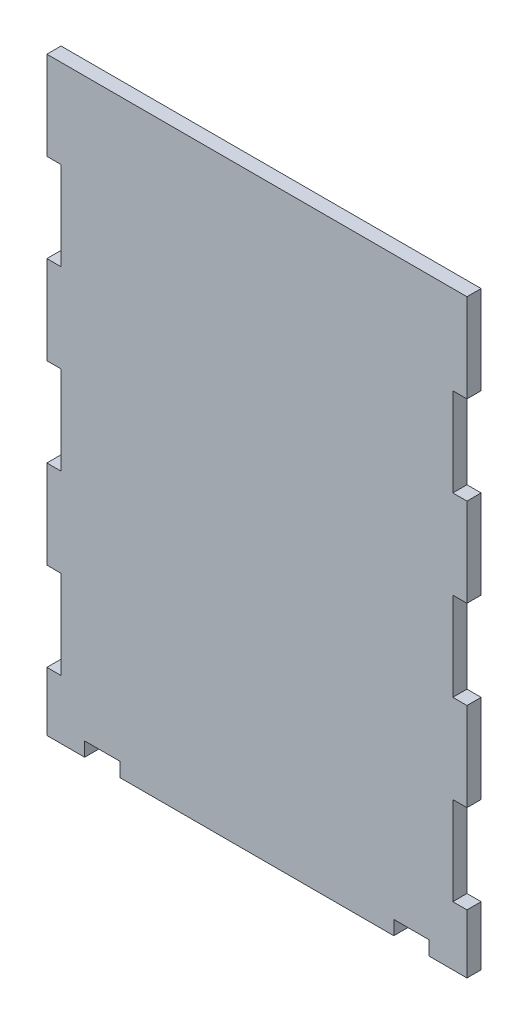
from build123d import *

# Parameters (mm, degrees)
SKETCH1_W            = 178
SKETCH1_H            = 250
BOSS_EXTRUDE1_DEPTH  = 6
SKETCH2_W            = 6
SKETCH2_H            = 37.5
CUT_EXTRUDE1_DEPTH   = 6
LPATTERN1_COUNT      = 3
LPATTERN1_PITCH      = 75
LPATTERN1_COUNT_DIR2 = 2
LPATTERN1_PITCH_DIR2 = 172
SKETCH3_W            = 15
SKETCH3_H            = 6
CUT_EXTRUDE2_DEPTH   = 307.952765096


with BuildPart() as part:
    # Sketch1 → Boss-Extrude1 (new body)
    with BuildSketch(Plane.XY):
        with Locations((-89, 125)):
            Rectangle(SKETCH1_W, SKETCH1_H)
    extrude(amount=BOSS_EXTRUDE1_DEPTH)

    # Sketch2 → Cut-Extrude1 (cut)
    with BuildSketch(Plane.XY.offset(6)):
        with Locations((-175, 193.75)):
            Rectangle(SKETCH2_W, SKETCH2_H)
    cut_extrude1 = extrude(amount=-CUT_EXTRUDE1_DEPTH, mode=Mode.SUBTRACT)

    # LPattern1: Cut-Extrude1 3 × 2
    with Locations(*[(j * LPATTERN1_PITCH_DIR2, -i * LPATTERN1_PITCH, 0) for i in range(LPATTERN1_COUNT) for j in range(LPATTERN1_COUNT_DIR2) if (i, j) != (0, 0)]):
        add(cut_extrude1, mode=Mode.SUBTRACT)

    # Sketch3 → Cut-Extrude2 (cut, through all)
    with BuildSketch(Plane.XY.offset(6)):
        with Locations((-23.5, 3)):
            Rectangle(SKETCH3_W, SKETCH3_H)
        with Locations((-154.5, 3)):
            Rectangle(SKETCH3_W, SKETCH3_H)
    extrude(amount=-CUT_EXTRUDE2_DEPTH, mode=Mode.SUBTRACT)


solid = part.part
